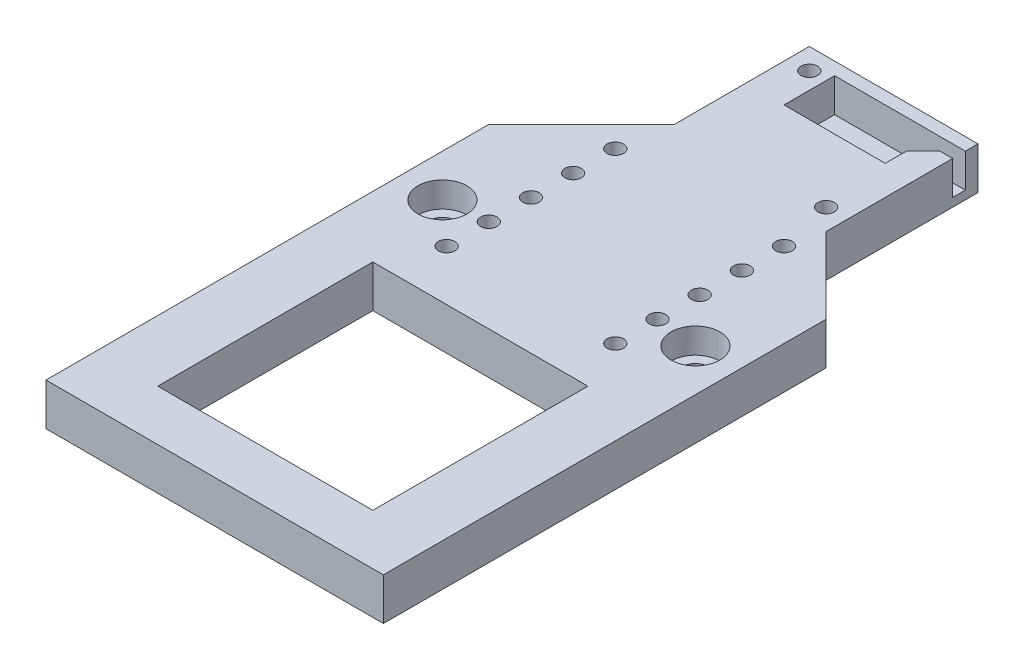
from build123d import *

# Parameters (mm, degrees)
SKETCH1_W           = 40
SKETCH1_H           = 45
SKETCH1_R           = 1.7
BOSS_EXTRUDE1_DEPTH = 5
SKETCH7_R           = 2.9
CUT_EXTRUDE6_DEPTH  = 3
SKETCH4_R           = 0.975
CUT_EXTRUDE3_DEPTH  = 31.516389039
SKETCH5_R           = 0.975
CUT_EXTRUDE4_DEPTH  = 31.516389039
LPATTERN1_COUNT     = 5
LPATTERN1_PITCH     = 5
CUT_EXTRUDE7_DEPTH  = 4
FILLET2_R           = 3
CHAMFER2_SIZE       = 2
CUT_EXTRUDE8_DEPTH  = 31.516389039
SKETCH10_W          = 40
SKETCH10_H          = 34.5
SKETCH10_W_2        = 25.5
SKETCH10_H_2        = 25.5
BOSS_EXTRUDE2_DEPTH = 5


with BuildPart() as part:
    # Sketch1 → Boss-Extrude1 (new body)
    with BuildSketch(Plane(origin=(0, 0, 0), x_dir=(1, 0, 0), z_dir=(0, 1, 0))):
        Rectangle(SKETCH1_W, SKETCH1_H)
        with Locations(Location((-15, 15, 0), (0, 0, 270))):
            Circle(SKETCH1_R, mode=Mode.SUBTRACT)
        with Locations(Location((-15, -15, 0), (0, 0, 270))):
            Circle(SKETCH1_R, mode=Mode.SUBTRACT)
        with Locations(Location((15, -15, 0), (0, 0, 90))):
            Circle(SKETCH1_R, mode=Mode.SUBTRACT)
        with Locations(Location((15, 15, 0), (0, 0, 90))):
            Circle(SKETCH1_R, mode=Mode.SUBTRACT)
    extrude(amount=BOSS_EXTRUDE1_DEPTH)

    # Sketch7 → Cut-Extrude6 (cut)
    with BuildSketch(Plane(origin=(0, 5, 0), x_dir=(1, 0, 0), z_dir=(0, 1, 0))):
        with Locations(Location((-15, 15, 0), (0, 0, 270))):
            Circle(SKETCH7_R)
        with Locations(Location((15, 15, 0), (0, 0, 270))):
            Circle(SKETCH7_R)
        with Locations(Location((-15, -15, 0), (0, 0, 270))):
            Circle(SKETCH7_R)
        with Locations(Location((15, -15, 0), (0, 0, 270))):
            Circle(SKETCH7_R)
    extrude(amount=-CUT_EXTRUDE6_DEPTH, mode=Mode.SUBTRACT)

    # Sketch4 → Cut-Extrude3 (cut, through all)
    with BuildSketch(Plane(origin=(0, 5, 0), x_dir=(1, 0, 0), z_dir=(0, 1, 0))):
        with Locations(Location((-6.5, 20, 0), (0, 0, 270))):
            Circle(SKETCH4_R)
        with Locations(Location((8.5, 7, 0), (0, 0, 270))):
            Circle(SKETCH4_R)
    extrude(amount=-CUT_EXTRUDE3_DEPTH, mode=Mode.SUBTRACT)

    # Sketch5 → Cut-Extrude4 (cut, through all)
    with BuildSketch(Plane(origin=(0, 5, 0), x_dir=(1, 0, 0), z_dir=(0, 1, 0))):
        with Locations(Location((-10, -19.5, 0), (0, 0, 270))):
            Circle(SKETCH5_R)
        with Locations(Location((10, -19.5, 0), (0, 0, 90))):
            Circle(SKETCH5_R)
    cut_extrude4 = extrude(amount=-CUT_EXTRUDE4_DEPTH, mode=Mode.SUBTRACT)

    # LPattern1: Cut-Extrude4 ×5
    with Locations(*[(0, 0, -i * LPATTERN1_PITCH) for i in range(1, LPATTERN1_COUNT)]):
        add(cut_extrude4, mode=Mode.SUBTRACT)

    # Sketch8 → Cut-Extrude7 (cut)
    with BuildSketch(Plane(origin=(0, 5, 0), x_dir=(1, 0, 0), z_dir=(0, 1, 0))):
        Polygon((-4.5, 21), (7.5, 21), (15.5, 21), (15.5, 19.5), (7.5, 19.5), (7.5, 15), (-4.5, 15), align=None)
    extrude(amount=-CUT_EXTRUDE7_DEPTH, mode=Mode.SUBTRACT)

    # Fillet2
    fillet2_edges = [part.edges().sort_by_distance(p)[0] for p in [
        (15.5, 1, -20.25),
    ]]
    fillet(fillet2_edges, radius=FILLET2_R)

    # Chamfer2
    chamfer2_edges = [part.edges().sort_by_distance(p)[0] for p in [
        (7.5, 3, -19.5),
    ]]
    chamfer(chamfer2_edges, length=CHAMFER2_SIZE)

    # Sketch9 → Cut-Extrude8 (cut, through all)
    with BuildSketch(Plane(origin=(0, 5, 0), x_dir=(1, 0, 0), z_dir=(0, 1, 0))):
        Polygon((-9, 22.5), (-9, 6.5), (-20, -4.5), (-20, 22.5), align=None)
        Polygon((20, 22.5), (11, 22.5), (11, 4.5), (20, -4.5), align=None)
    extrude(amount=-CUT_EXTRUDE8_DEPTH, mode=Mode.SUBTRACT)

    # Sketch10 → Boss-Extrude2 (add)
    with BuildSketch(Plane(origin=(0, 5, 0), x_dir=(1, 0, 0), z_dir=(0, 1, 0))):
        with Locations((0, -39.75)):
            Rectangle(SKETCH10_W, SKETCH10_H)
        with Locations((0, -38.25)):
            Rectangle(SKETCH10_W_2, SKETCH10_H_2, mode=Mode.SUBTRACT)
    extrude(amount=-BOSS_EXTRUDE2_DEPTH)


solid = part.part
